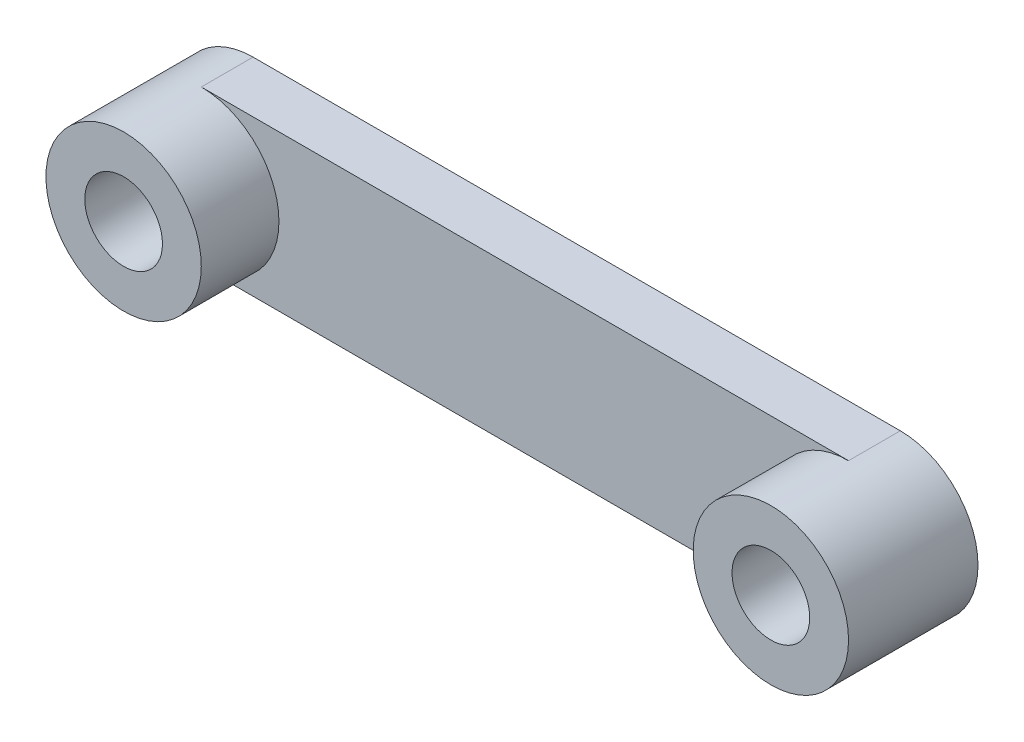
from build123d import *

# Parameters (mm, degrees)
SKETCH_1_R      = 1.5
EXTRUDE_1_DEPTH = 1
SKETCH_1_4_R    = 3
SKETCH_1_4_R_2  = 1.5
EXTRUDE_3_DEPTH = 4


with BuildPart() as part:
    # Эскиз1 → Бобышка-Вытянуть1 (new, symmetric)
    with BuildSketch(Plane.XY):
        with BuildLine():
            Line((12.5, 3), (-12.5, 3))
            ThreePointArc((-12.5, 3), (-15.5, 0), (-12.5, -3))
            Line((-12.5, -3), (12.5, -3))
            ThreePointArc((12.5, -3), (15.5, 0), (12.5, 3))
        make_face()
        with Locations((12.5, 0)):
            Circle(SKETCH_1_R, mode=Mode.SUBTRACT)
        with Locations((-12.5, 0)):
            Circle(SKETCH_1_R, mode=Mode.SUBTRACT)
    extrude(amount=EXTRUDE_1_DEPTH, both=True)

    # Эскиз1<4> → Бобышка-Вытянуть3 (add)
    # profile 1 of 2: a face of its own
    with BuildSketch(Plane.XY):
        with Locations((-12.5, 0)):
            Circle(SKETCH_1_4_R)
        with Locations((-12.5, 0)):
            Circle(SKETCH_1_4_R_2, mode=Mode.SUBTRACT)
    # profile 2 of 2: a face of its own
    with BuildSketch(Plane.XY):
        with Locations((12.5, 0)):
            Circle(SKETCH_1_4_R)
        with Locations((12.5, 0)):
            Circle(SKETCH_1_4_R_2, mode=Mode.SUBTRACT)
    extrude(amount=EXTRUDE_3_DEPTH)


solid = part.part
